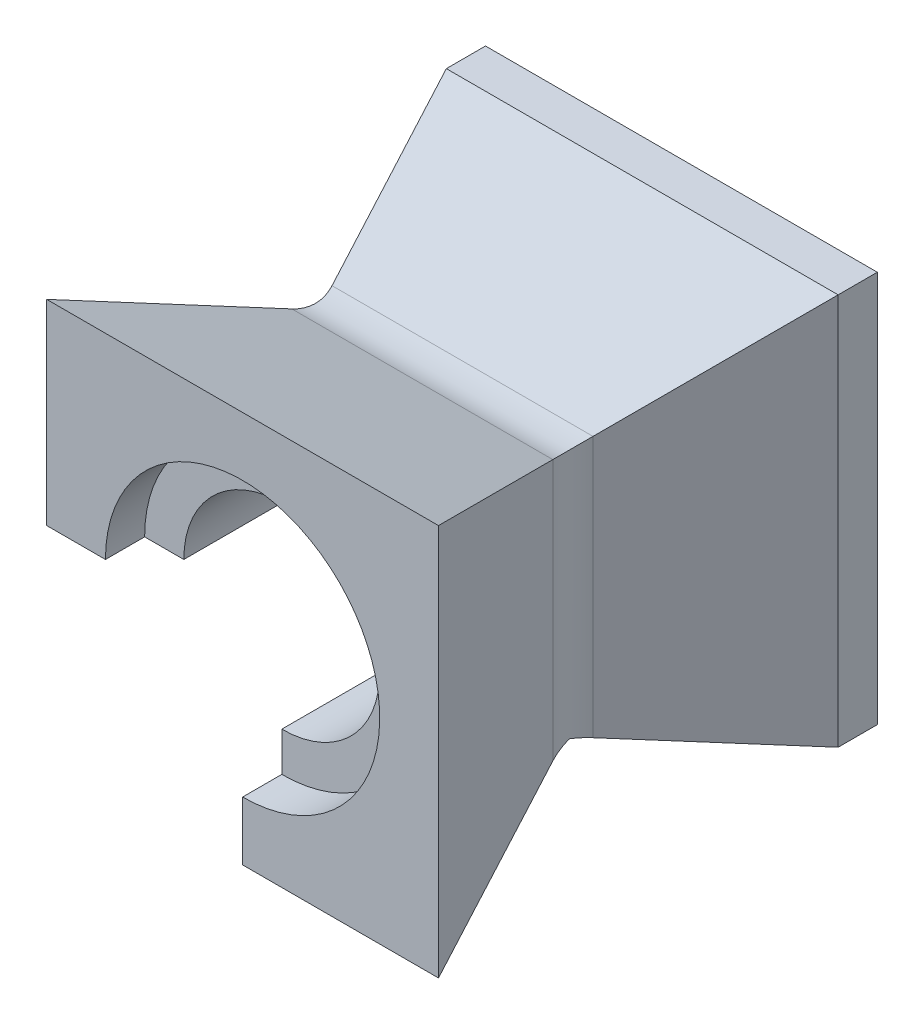
from build123d import *

# Parameters (mm, degrees)
ESQUISSE2_W                  = 100
ESQUISSE2_H                  = 100
BOSS_EXTRU_1_DEPTH           = 51
BOSS_EXTRU_1_TAPER           = 20
ENL_V_MAT_EXTRU_1_DEPTH      = 140.622233322
ENL_V_MAT_EXTRU_1_DEPTH_BACK = 140.622233322
ESQUISSE3_R                  = 25
ENL_V_MAT_EXTRU_2_DEPTH      = 140.622233322
ENL_V_MAT_EXTRU_2_DEPTH_BACK = 10
ESQUISSE5_R                  = 35
ENL_V_START                  = -10
ESQUISSE6_R                  = 35
ENL_V_MAT_EXTRU_3_DEPTH      = 10
ESQUISSE7_W                  = 50
ESQUISSE7_H                  = 50
ENL_V_MAT_EXTRU_4_DEPTH      = 140.622233322
CONG_1_R                     = 15
ENL_V_MAT_EXTRU_8_DEPTH      = 10
BOSS_EXTRU_2_DEPTH           = 10


with BuildPart() as part:
    # Esquisse2 → Boss.-Extru.1 (new body)
    with BuildSketch(Plane.XY):
        with Locations((-23.410404624, -10.838150289)):
            Rectangle(ESQUISSE2_W, ESQUISSE2_H)
    boss_extru_1 = extrude(amount=BOSS_EXTRU_1_DEPTH, taper=BOSS_EXTRU_1_TAPER)

    # Symétrie4: Boss.-Extru.1 across plane
    add(boss_extru_1.mirror(Plane.XY.offset(51)))

    # Esquisse3 → Enlèv. mat.-Extru.1 (cut, two sides: drawn at the far end of the back side and taken through both)
    with BuildSketch(Plane.XY.offset(102).offset(-ENL_V_MAT_EXTRU_1_DEPTH_BACK)):
        with Locations((-23.410404624, -10.838150289)):
            Circle(ESQUISSE3_R)
    extrude(amount=ENL_V_MAT_EXTRU_1_DEPTH + ENL_V_MAT_EXTRU_1_DEPTH_BACK, mode=Mode.SUBTRACT)

    # Esquisse5 → Enlèv. mat.-Extru.2 (cut, two sides: drawn at the far end of the back side and taken through both)
    with BuildSketch(Plane.XY.offset(102).offset(-ENL_V_MAT_EXTRU_2_DEPTH_BACK)):
        with Locations(Location((-23.410404624, -10.838150289, 0), (0, 0, 180))):
            Circle(ESQUISSE5_R)
    extrude(amount=ENL_V_MAT_EXTRU_2_DEPTH + ENL_V_MAT_EXTRU_2_DEPTH_BACK, mode=Mode.SUBTRACT)

    # Esquisse6 → Enlèv. mat.-Extru.3 (cut)
    with BuildSketch(Plane(origin=(0, 0, 0), x_dir=(-1, 0, 0), z_dir=(0, 0, -1)).offset(ENL_V_START)):
        with Locations((23.410404624, -10.838150289)):
            Circle(ESQUISSE6_R)
    extrude(amount=ENL_V_MAT_EXTRU_3_DEPTH, mode=Mode.SUBTRACT)

    # Esquisse7 → Enlèv. mat.-Extru.4 (cut, through all)
    with BuildSketch(Plane(origin=(0, 0, 0), x_dir=(-1, 0, 0), z_dir=(0, 0, -1))):
        with Locations((48.410404624, -35.838150289)):
            Rectangle(ESQUISSE7_W, ESQUISSE7_H)
    extrude(amount=-ENL_V_MAT_EXTRU_4_DEPTH, mode=Mode.SUBTRACT)

    # Congé1
    cong_1_edges = [part.edges().sort_by_distance(p)[0] for p in [
        (8.027113428, -10.838150289, 51),
        (-23.410404624, 20.599367763, 51),
        (-54.847922677, 4.880608737, 51),
    ]]
    fillet(cong_1_edges, radius=CONG_1_R)

    # Esquisse8 → Enlèv. mat.-Extru.8 (cut)
    with BuildSketch(Plane(origin=(0, 0, 0), x_dir=(-1, 0, 0), z_dir=(0, 0, -1))):
        with BuildLine():
            Line((-15.12691495, 31.941809973), (-4.520313233, 21.335208255))
            ThreePointArc((-4.520313233, 21.335208255), (-4.520313233, 17.092567568), (-8.76295392, 17.092567568))
            Line((-8.76295392, 17.092567568), (-19.369555638, 27.699169286))
            ThreePointArc((-19.369555638, 27.699169286), (-19.369555638, 31.941809973), (-15.12691495, 31.941809973))
        make_face()
        with BuildLine():
            Line((-19.369555638, -49.375469864), (-8.76295392, -38.768868146))
            ThreePointArc((-8.76295392, -38.768868146), (-4.520313233, -38.768868146), (-4.520313233, -43.011508833))
            Line((-4.520313233, -43.011508833), (-15.12691495, -53.618110551))
            ThreePointArc((-15.12691495, -53.618110551), (-19.369555638, -53.618110551), (-19.369555638, -49.375469864))
        make_face()
        with BuildLine():
            Line((51.341122481, 21.335208255), (61.947724199, 31.941809973))
            ThreePointArc((61.947724199, 31.941809973), (66.190364886, 31.941809973), (66.190364886, 27.699169286))
            Line((66.190364886, 27.699169286), (55.583763168, 17.092567568))
            ThreePointArc((55.583763168, 17.092567568), (51.341122481, 17.092567568), (51.341122481, 21.335208255))
        make_face()
    extrude(amount=-ENL_V_MAT_EXTRU_8_DEPTH, mode=Mode.SUBTRACT)

    # Esquisse9 → Boss.-Extru.2 (add)
    with BuildSketch(Plane(origin=(0, 0, 0), x_dir=(-1, 0, 0), z_dir=(0, 0, -1))):
        Polygon((-26.589595376, -60.838150289), (23.410404624, -60.838150289), (23.410404624, -57.838150289), (-23.589595376, -57.838150289), (-23.589595376, 36.161849711), (70.410404624, 36.161849711), (70.410404624, -10.838150289), (73.410404624, -10.838150289), (73.410404624, 39.161849711), (-26.589595376, 39.161849711), align=None)
    extrude(amount=BOSS_EXTRU_2_DEPTH)


solid = part.part
